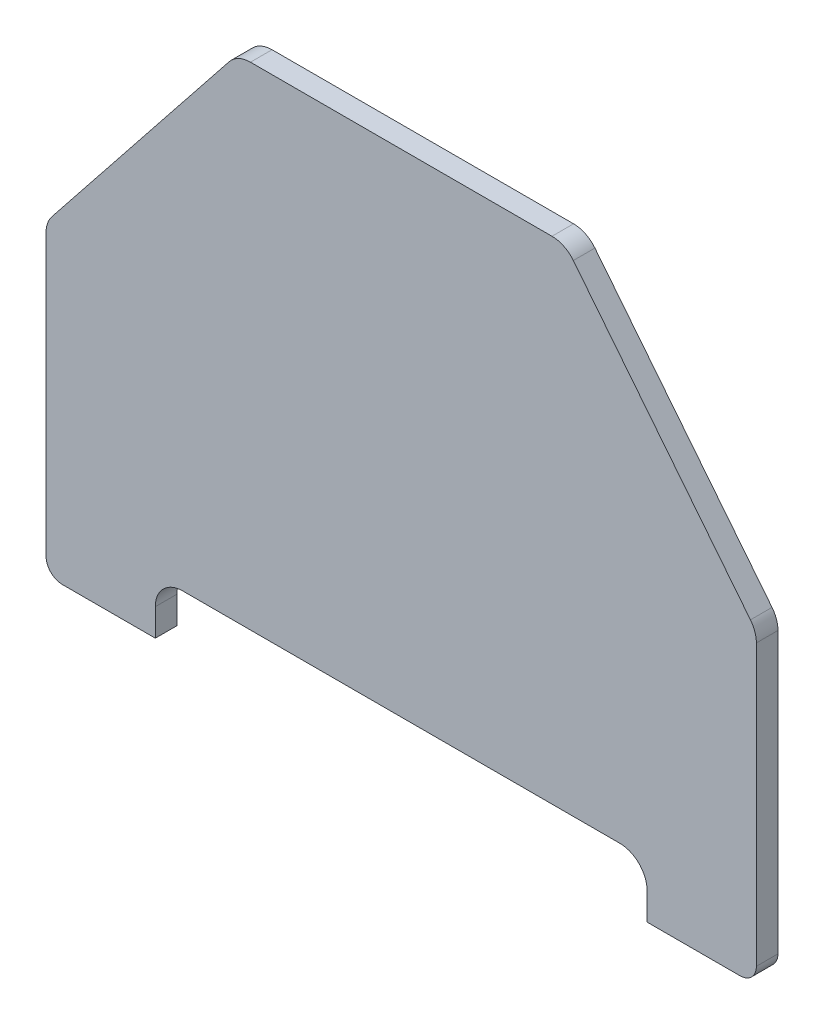
from build123d import *

# Parameters (mm, degrees)
BOSS_EXTRUDE2_DEPTH = 3.95
FILLET1_R           = 5
FILLET2_R           = 3


with BuildPart() as part:
    # Sketch1 → Boss-Extrude2 (new body)
    with BuildSketch(Plane.XY):
        Polygon((0, 56), (35, 100), (95, 100), (130, 56), (130, 0), (110, 0), (110, 10), (20, 10), (20, 0), (0, 0), align=None)
    extrude(amount=BOSS_EXTRUDE2_DEPTH)

    # Fillet1
    fillet1_edges = [part.edges().sort_by_distance(p)[0] for p in [
        (110, 10, 1.975),
        (20, 10, 1.975),
        (0, 56, 1.975),
        (35, 100, 1.975),
        (95, 100, 1.975),
        (130, 56, 1.975),
    ]]
    fillet(fillet1_edges, radius=FILLET1_R)

    # Fillet2
    fillet2_edges = [part.edges().sort_by_distance(p)[0] for p in [
        (0, 0, 1.975),
        (130, 0, 1.975),
    ]]
    fillet(fillet2_edges, radius=FILLET2_R)


solid = part.part
